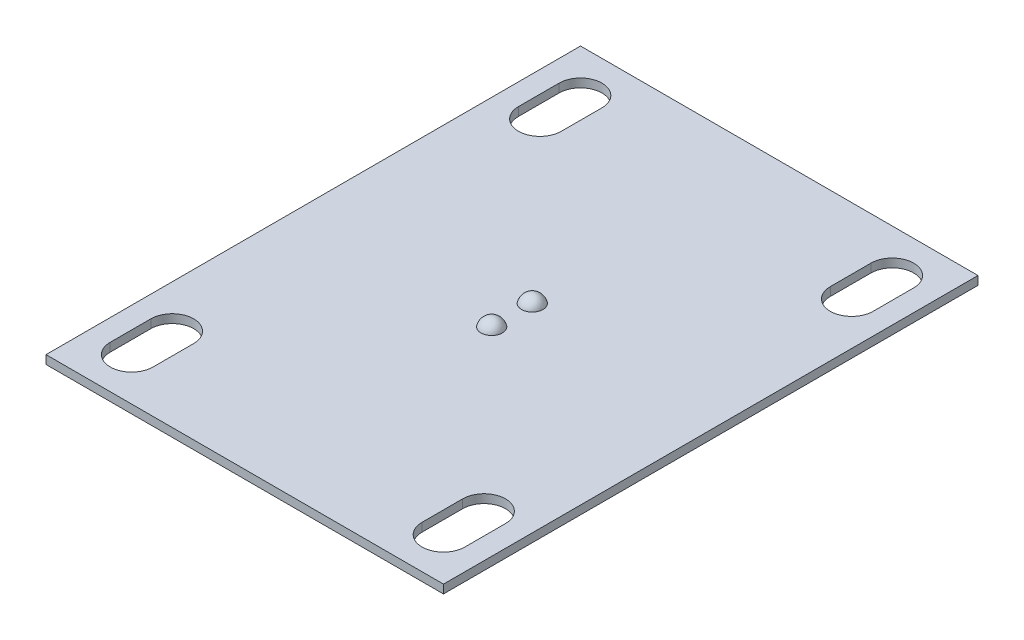
from build123d import *

# Parameters (mm, degrees)
SKETCH1_W           = 92.8
SKETCH1_H           = 124.8
BOSS_EXTRUDE1_DEPTH = 2
CUT_EXTRUDE1_DEPTH  = 92.082431134


with BuildPart() as part:
    # Sketch1 → Boss-Extrude1 (new body)
    with BuildSketch(Plane(origin=(0, -2.3, 0), x_dir=(-1, 0, 0), z_dir=(0, -1, 0))):
        with Locations((-1, -15.351201027)):
            Rectangle(SKETCH1_W, SKETCH1_H)
    extrude(amount=BOSS_EXTRUDE1_DEPTH)

    # Sketch3 → Revolve2 (revolve)
    with BuildSketch(Plane.ZY.offset(-1), mode=Mode.PRIVATE) as revolve2_sk:
        with BuildLine():
            Line((8.11798754, -2.3), (10.61798754, -2.3))
            Line((10.61798754, -2.3), (10.61798754, -0.3))
            ThreePointArc((10.61798754, -0.3), (9.017206481, -0.861523676), (8.11798754, -2.3))
        make_face()
    revolve(revolve2_sk.sketch.rotate(Axis((1, -0.3, 10.61798754), (0, -1, 0)), 180), axis=Axis((1, -0.3, 10.61798754), (0, -1, 0)))

    # Sketch5 → Revolve3 (revolve)
    with BuildSketch(Plane.ZY.offset(-1)):
        with BuildLine():
            Line((20.10120103, -2.3), (20.10120103, -0.3))
            ThreePointArc((20.10120103, -0.3), (18.500419971, -0.861523676), (17.60120103, -2.3))
            Line((17.60120103, -2.3), (20.10120103, -2.3))
        make_face()
    revolve(axis=Axis((1, -2.3, 20.10120103), (0, 1, 0)))

    # Sketch6 → Cut-Extrude1 (cut, through all)
    with BuildSketch(Plane(origin=(0, -2.3, 0), x_dir=(1, 0, 0), z_dir=(0, 1, 0))):
        with BuildLine():
            Line((-30.4, 37.048798973), (-30.4, 27.565585483))
            ThreePointArc((-30.4, 27.565585483), (-35.4, 22.565585483), (-40.4, 27.565585483))
            Line((-40.4, 27.565585483), (-40.4, 37.048798973))
            ThreePointArc((-40.4, 37.048798973), (-35.4, 42.048798973), (-30.4, 37.048798973))
        make_face()
        with BuildLine():
            Line((-30.4, -58.267987537), (-30.4, -67.751201027))
            ThreePointArc((-30.4, -67.751201027), (-35.4, -72.751201027), (-40.4, -67.751201027))
            Line((-40.4, -67.751201027), (-40.4, -58.267987537))
            ThreePointArc((-40.4, -58.267987537), (-35.4, -53.267987537), (-30.4, -58.267987537))
        make_face()
    cut_extrude1 = extrude(amount=-CUT_EXTRUDE1_DEPTH, mode=Mode.SUBTRACT)

    # Mirror1: Cut-Extrude1 across plane
    add(cut_extrude1.mirror(Plane.ZY.offset(-1)), mode=Mode.SUBTRACT)


solid = part.part
